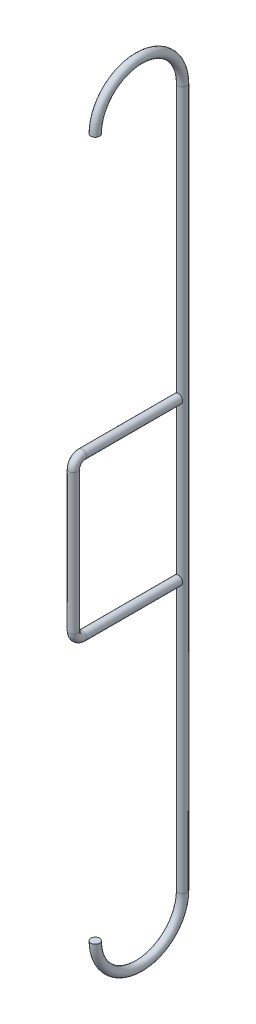
from build123d import *

# Parameters (mm, degrees)
SKETCH2_R = 3.175
SKETCH5_R = 3.175


with BuildPart() as part:
    # Sweep1: sweep along a path in Sketch1
    with BuildLine(Plane(origin=(0, 0, 0), x_dir=(0, 0, -1), z_dir=(1, 0, 0))) as sweep1_path:
        ThreePointArc((-31.75, 254), (0, 285.75), (31.75, 254))
        Line((31.75, 254), (31.75, -254))
        ThreePointArc((31.75, -254), (0, -285.75), (-31.75, -254))
    # Sketch2 → Sweep1 (sweep)
    with BuildSketch(Plane(origin=(0, 254, 0), x_dir=(1, 0, 0), z_dir=(0, 1, 0))):
        with Locations((0, -31.75)):
            Circle(SKETCH2_R)
    sweep(path=sweep1_path.line)


with BuildPart() as body_2:
    # Sweep2: sweep along a path in Sketch4
    with BuildLine(Plane(origin=(0, 0, 0), x_dir=(0, 0, -1), z_dir=(1, 0, 0))) as sweep2_path:
        Line((28.575, 57.15), (-41.275, 57.15))
        ThreePointArc((-41.275, 57.15), (-45.765128061, 55.290128061), (-47.625, 50.8))
        Line((-47.625, 50.8), (-47.625, -50.8))
        ThreePointArc((-47.625, -50.8), (-45.765128061, -55.290128061), (-41.275, -57.15))
        Line((-41.275, -57.15), (28.575, -57.15))
    # Sketch5 → Sweep2 (sweep)
    with BuildSketch(Plane.XY.offset(-28.575)):
        with Locations((0, 57.15)):
            Circle(SKETCH5_R)
    sweep(path=sweep2_path.line)


solid = Compound([part.part, body_2.part])
